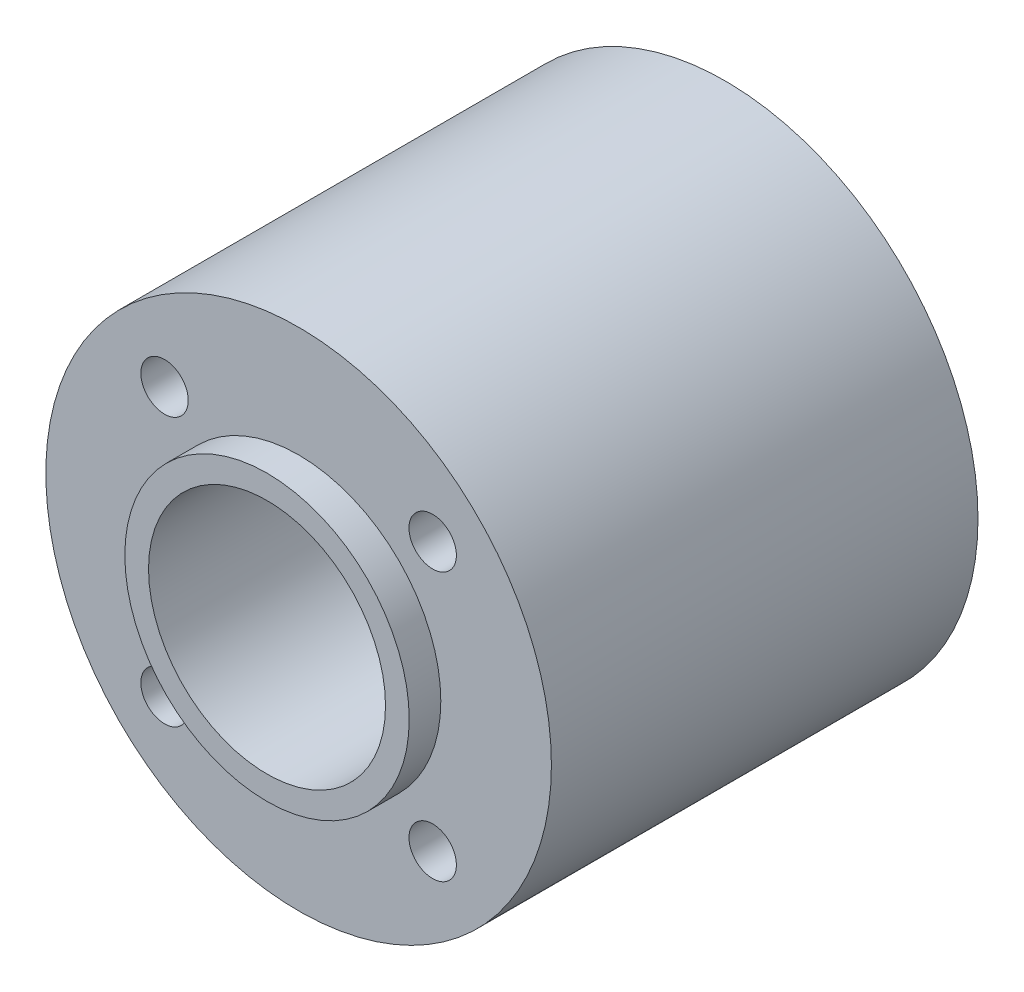
from build123d import *

# Parameters (mm, degrees)
ESQUISSE3_R             = 16
ESQUISSE3_R_2           = 9
BOSS_EXTRU_1_DEPTH      = 27
ESQUISSE3_3_R           = 9
ESQUISSE3_3_R_2         = 7.5
BOSS_EXTRU_2_DEPTH      = 2
ESQUISSE7_R             = 9
ESQUISSE7_R_2           = 7.5
BOSS_EXTRU_3_DEPTH      = 30
ESQUISSE8_R             = 1.5
ENL_V_MAT_EXTRU_1_DEPTH = 30


with BuildPart() as part:
    # Esquisse3 → Boss.-Extru.1 (new body)
    with BuildSketch(Plane.XY):
        Circle(ESQUISSE3_R)
        Circle(ESQUISSE3_R_2, mode=Mode.SUBTRACT)
    extrude(amount=-BOSS_EXTRU_1_DEPTH)



with BuildPart() as body_2:
    # Esquisse3<3> → Boss.-Extru.2 (new body)
    with BuildSketch(Plane.XY):
        Circle(ESQUISSE3_3_R)
        Circle(ESQUISSE3_3_R_2, mode=Mode.SUBTRACT)
    extrude(amount=BOSS_EXTRU_2_DEPTH)


with BuildPart() as part_1:
    add(part.part)

    add(body_2.part)  # Boss.-Extru.3 merges body 2
    # Esquisse7 → Boss.-Extru.3 (add)
    with BuildSketch(Plane(origin=(0, 0, 0), x_dir=(-1, 0, 0), z_dir=(0, 0, -1))):
        Circle(ESQUISSE7_R)
        Circle(ESQUISSE7_R_2, mode=Mode.SUBTRACT)
    extrude(amount=BOSS_EXTRU_3_DEPTH)

    # Esquisse8 → Enlèv. mat.-Extru.1 (cut)
    with BuildSketch(Plane.XY):
        with Locations((-8.485281374, 8.485281374)):
            Circle(ESQUISSE8_R)
        with Locations((8.485281374, 8.485281374)):
            Circle(ESQUISSE8_R)
    enl_v_mat_extru_1 = extrude(amount=-ENL_V_MAT_EXTRU_1_DEPTH, mode=Mode.SUBTRACT)

    # Symétrie1: Enlèv. mat.-Extru.1 across plane
    add(enl_v_mat_extru_1.mirror(Plane.ZX), mode=Mode.SUBTRACT)


solid = part_1.part
